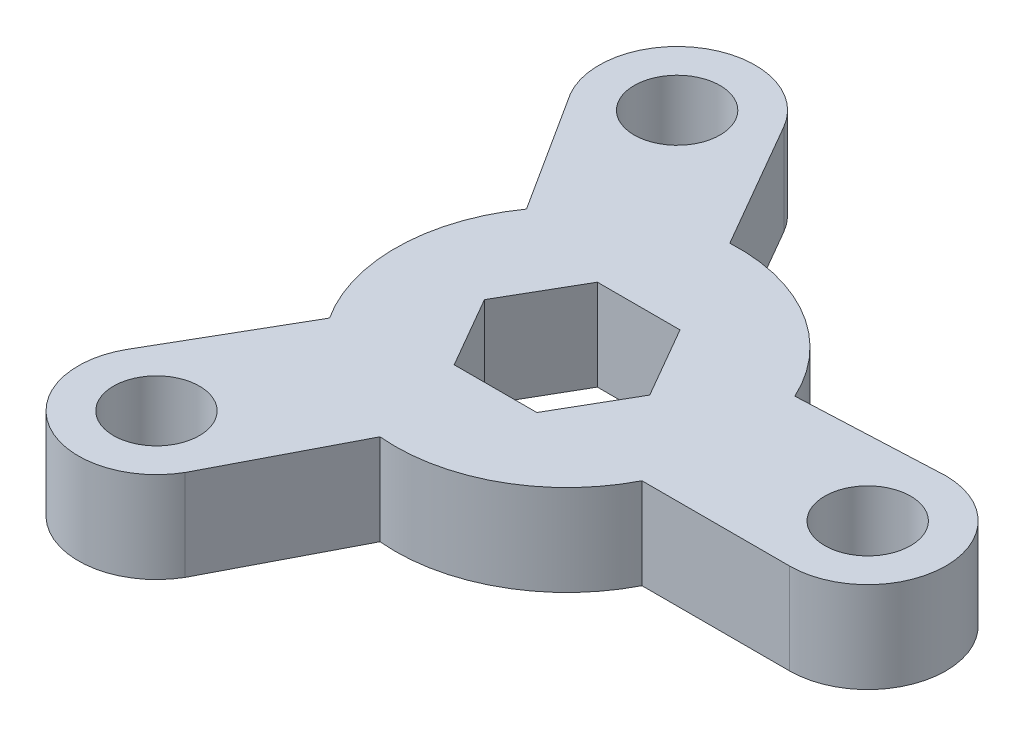
from build123d import *

# Parameters (mm, degrees)
SKETCH1_R           = 1.5
BOSS_EXTRUDE1_DEPTH = 3.175


with BuildPart() as part:
    # Sketch1 → Boss-Extrude1 (new body)
    with BuildSketch(Plane(origin=(0, 0, 0), x_dir=(1, 0, 0), z_dir=(0, 1, 0))):
        with BuildLine():
            Line((7.858300919, -2.484134681), (13.014762042, -2.484134681))
            ThreePointArc((13.014762042, -2.484134681), (15.743606535, 0.244709812), (13.014762042, 2.973554305))
            Line((13.014762042, 2.973554305), (7.969118099, 2.744709812))
            ThreePointArc((7.969118099, 2.744709812), (5.624188125, 5.376129638), (2.206241257, 6.236772472))
            Line((2.206241257, 6.236772472), (-0.371989304, 10.702398798))
            ThreePointArc((-0.371989304, 10.702398798), (-4.099660205, 11.701225206), (-5.098486612, 7.973554305))
            Line((-5.098486612, 7.973554305), (-2.377479496, 3.718320719))
            ThreePointArc((-2.377479496, 3.718320719), (-3.483890927, 0.371841879), (-2.520256051, -3.018508355))
            Line((-2.520256051, -3.018508355), (-5.098486612, -7.484134681))
            ThreePointArc((-5.098486612, -7.484134681), (-4.099660205, -11.211805582), (-0.371989304, -10.212979174))
            Line((-0.371989304, -10.212979174), (1.952647522, -5.728901095))
            ThreePointArc((1.952647522, -5.728901095), (5.403988927, -5.013842081), (7.858300919, -2.484134681))
        make_face()
        Polygon((3.958137715, 2.744709812), (5.401513388, 0.244709812), (3.958137715, -2.255290188), (1.071386369, -2.255290188), (-0.371989304, 0.244709812), (1.071386369, 2.744709812), align=None, mode=Mode.SUBTRACT)
        with Locations(Location((13.014762042, 0.244709812, 0), (0, 0, 270))):
            Circle(SKETCH1_R, mode=Mode.SUBTRACT)
        with Locations(Location((-2.735237958, 9.337976552, 0), (0, 0, 270))):
            Circle(SKETCH1_R, mode=Mode.SUBTRACT)
        with Locations(Location((-2.735237958, -8.848556928, 0), (0, 0, 270))):
            Circle(SKETCH1_R, mode=Mode.SUBTRACT)
    extrude(amount=BOSS_EXTRUDE1_DEPTH)


solid = part.part
